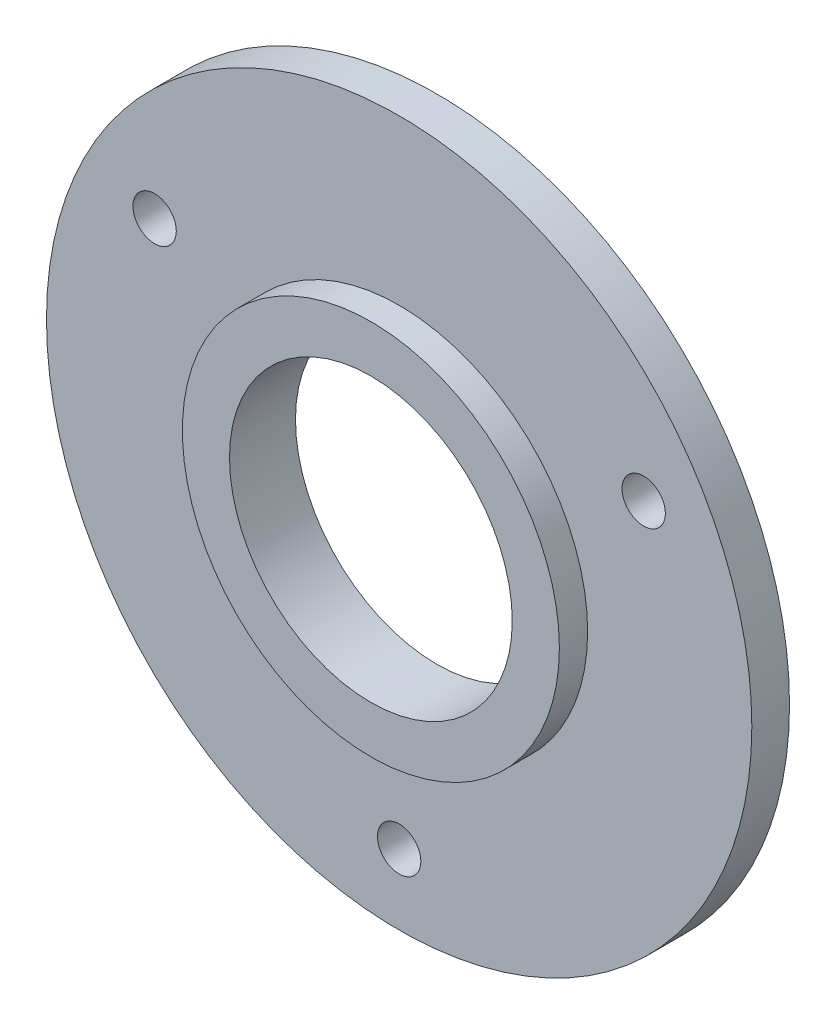
from build123d import *

# Parameters (mm, degrees)
SKETCH1_R           = 18.71
SKETCH1_R_2         = 1.15
SKETCH1_R_3         = 7.5
BOSS_EXTRUDE1_DEPTH = 2
SKETCH2_R           = 10
SKETCH2_R_2         = 7.5
BOSS_EXTRUDE2_DEPTH = 1.5


with BuildPart() as part:
    # Sketch1 → Boss-Extrude1 (new body)
    with BuildSketch(Plane.XY):
        Circle(SKETCH1_R)
        with Locations((0, -14.98)):
            Circle(SKETCH1_R_2, mode=Mode.SUBTRACT)
        with Locations((-12.973060549, 7.49)):
            Circle(SKETCH1_R_2, mode=Mode.SUBTRACT)
        with Locations((12.973060549, 7.49)):
            Circle(SKETCH1_R_2, mode=Mode.SUBTRACT)
        Circle(SKETCH1_R_3, mode=Mode.SUBTRACT)
    extrude(amount=BOSS_EXTRUDE1_DEPTH)

    # Sketch2 → Boss-Extrude2 (add)
    with BuildSketch(Plane.XY.offset(2)):
        Circle(SKETCH2_R)
        Circle(SKETCH2_R_2, mode=Mode.SUBTRACT)
    extrude(amount=BOSS_EXTRUDE2_DEPTH)


solid = part.part
